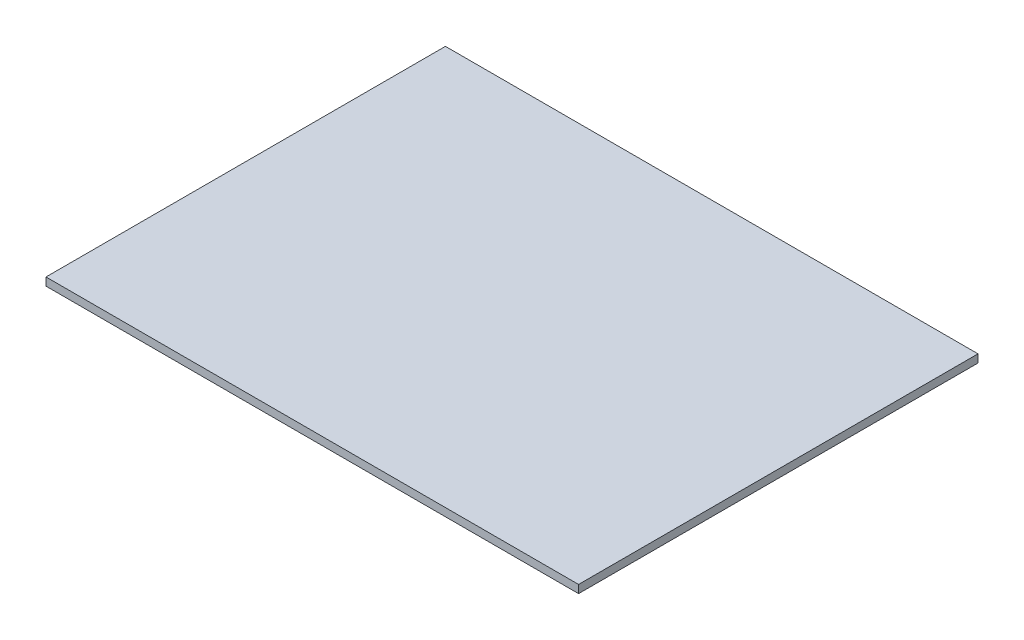
from build123d import *

# Parameters (mm, degrees)
SKETCH1_W           = 508
SKETCH1_H           = 381
BOSS_EXTRUDE1_DEPTH = 7.62


with BuildPart() as part:
    # Sketch1 → Boss-Extrude1 (new body)
    with BuildSketch(Plane(origin=(0, 0, 0), x_dir=(1, 0, 0), z_dir=(0, 1, 0))):
        with Locations((254, -190.5)):
            Rectangle(SKETCH1_W, SKETCH1_H)
    extrude(amount=BOSS_EXTRUDE1_DEPTH)


solid = part.part
